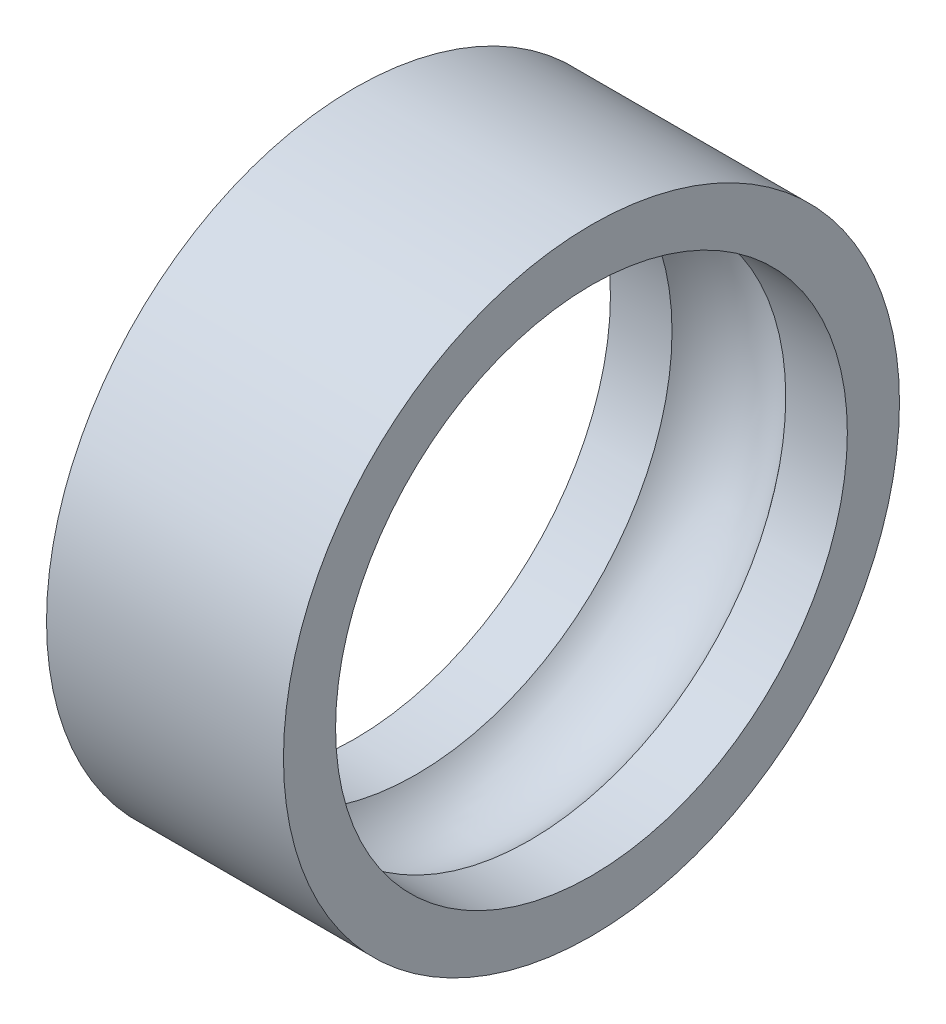
from build123d import *


with BuildPart() as part:
    # Çizim2 → Döndür1 (revolve)
    with BuildSketch(Plane.XY, mode=Mode.PRIVATE) as d_nd_r1_sk:
        with BuildLine():
            Line((-2.5, 6.5), (2.5, 6.5))
            Line((2.5, 6.5), (2.5, 5.4))
            Line((2.5, 5.4), (1.2, 5.4))
            ThreePointArc((1.2, 5.4), (0, 6), (-1.2, 5.4))
            Line((-1.2, 5.4), (-2.5, 5.4))
            Line((-2.5, 5.4), (-2.5, 6.5))
        make_face()
    revolve(d_nd_r1_sk.sketch.rotate(Axis((0, 0, 0), (-1, 0, 0)), 90), axis=Axis((0, 0, 0), (-1, 0, 0)))


solid = part.part
